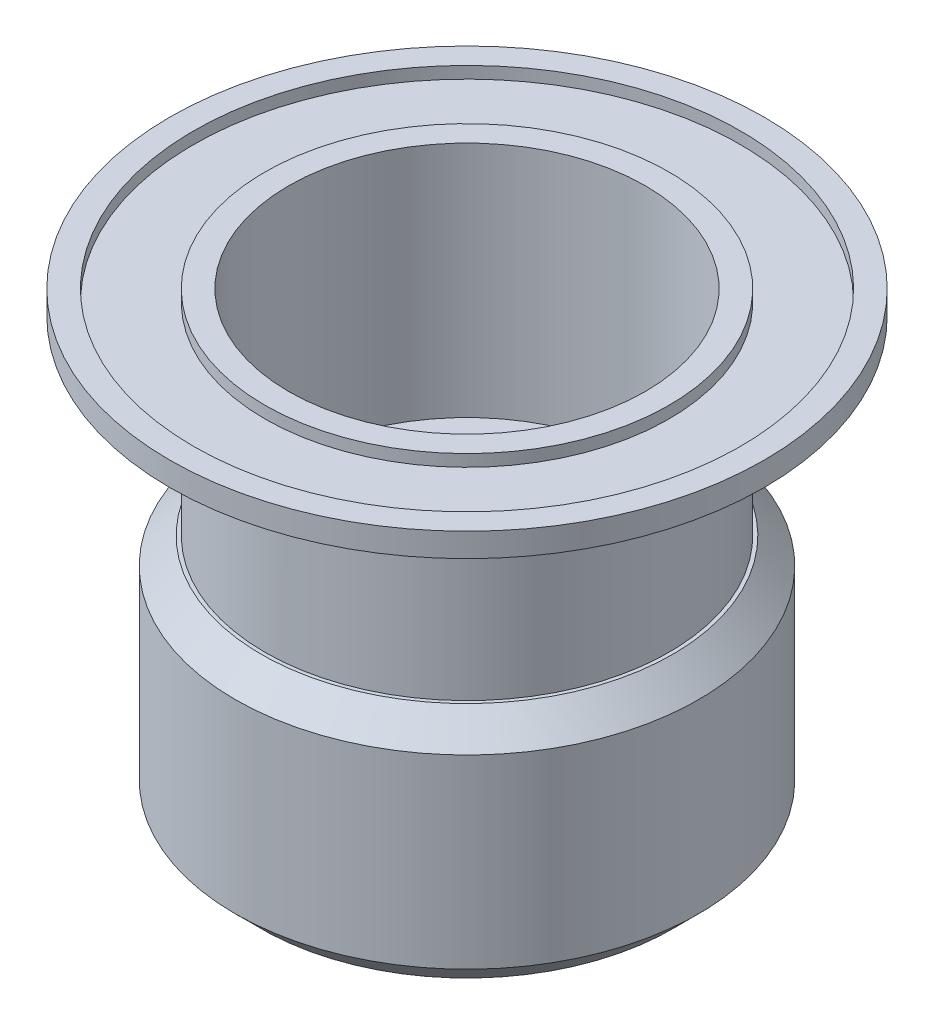
from build123d import *

# Parameters (mm, degrees)
SKETCH_3_R          = 23
SKETCH_3_R_2        = 17
CUT_EXTRUDE_1_DEPTH = 1
SKETCH_4_W          = 10
SKETCH_4_H          = 10
CUT_EXTRUDE_2_DEPTH = 1.5
SKETCH_5_R          = 4
CUT_EXTRUDE_3_DEPTH = 41.620192023
SKETCH_9_R          = 17
SKETCH_9_R_2        = 4
EXTRUDE_1_DEPTH     = 1
SKETCH_10_R         = 17
SKETCH_10_R_2       = 15
EXTRUDE_2_DEPTH     = 15
SKETCH_11_R         = 2.75
CUT_EXTRUDE_4_DEPTH = 42.379342672
EXTRUDE_START       = -20
SKETCH_12_R         = 19.5
SKETCH_12_R_2       = 17
EXTRUDE_3_DEPTH     = 20
CHAMFER_1_SIZE      = 2.195


with BuildPart() as part:
    # Эскиз2 → Повернуть1 (revolve)
    with BuildSketch(Plane.XY, mode=Mode.PRIVATE) as revolve_1_sk:
        Polygon((15, 0), (15, -20), (0, -20), (0, -22), (17, -22), (17, -2), (25, -2), (25, 0), align=None)
    revolve(revolve_1_sk.sketch.rotate(Axis((0, 0, 0), (0, -1, 0)), 90), axis=Axis((0, 0, 0), (0, -1, 0)))

    # Эскиз3 → Вырез-Вытянуть1 (cut)
    with BuildSketch(Plane(origin=(0, 0, 0), x_dir=(1, 0, 0), z_dir=(0, 1, 0))):
        with Locations(Location((0, 0, 0), (0, 0, 270))):
            Circle(SKETCH_3_R)
        with Locations(Location((0, 0, 0), (0, 0, 270))):
            Circle(SKETCH_3_R_2, mode=Mode.SUBTRACT)
    extrude(amount=-CUT_EXTRUDE_1_DEPTH, mode=Mode.SUBTRACT)

    # Эскиз4 → Вырез-Вытянуть2 (cut)
    with BuildSketch(Plane(origin=(0, -20, 0), x_dir=(1, 0, 0), z_dir=(0, 1, 0))):
        Rectangle(SKETCH_4_W, SKETCH_4_H)
    extrude(amount=-CUT_EXTRUDE_2_DEPTH, mode=Mode.SUBTRACT)

    # Эскиз5 → Вырез-Вытянуть3 (cut, through all)
    with BuildSketch(Plane(origin=(0, -20, 0), x_dir=(1, 0, 0), z_dir=(0, 1, 0))):
        with Locations(Location((0, 10, 0), (0, 0, 270))):
            Circle(SKETCH_5_R)
        with Locations(Location((10, 0, 0), (0, 0, 270))):
            Circle(SKETCH_5_R)
        with Locations(Location((0, -10, 0), (0, 0, 270))):
            Circle(SKETCH_5_R)
        with Locations(Location((-10, 0, 0), (0, 0, 270))):
            Circle(SKETCH_5_R)
    extrude(amount=-CUT_EXTRUDE_3_DEPTH, mode=Mode.SUBTRACT)

    # Эскиз9 → Бобышка-Вытянуть1 (add)
    with BuildSketch(Plane.XZ.offset(22)):
        with Locations(Location((0, 0, 0), (0, 0, 90))):
            Circle(SKETCH_9_R)
        with Locations(Location((0, 10, 0), (0, 0, 90))):
            Circle(SKETCH_9_R_2, mode=Mode.SUBTRACT)
        with Locations(Location((-10, 0, 0), (0, 0, 90))):
            Circle(SKETCH_9_R_2, mode=Mode.SUBTRACT)
        with Locations(Location((0, -10, 0), (0, 0, 90))):
            Circle(SKETCH_9_R_2, mode=Mode.SUBTRACT)
        with Locations(Location((10, 0, 0), (0, 0, 90))):
            Circle(SKETCH_9_R_2, mode=Mode.SUBTRACT)
    extrude(amount=EXTRUDE_1_DEPTH)

    # Эскиз10 → Бобышка-Вытянуть2 (add)
    with BuildSketch(Plane.XZ.offset(23)):
        with Locations(Location((0, 0, 0), (0, 0, 90))):
            Circle(SKETCH_10_R)
        with Locations(Location((0, 0, 0), (0, 0, 90))):
            Circle(SKETCH_10_R_2, mode=Mode.SUBTRACT)
    extrude(amount=EXTRUDE_2_DEPTH)

    # Эскиз11 → Вырез-Вытянуть4 (cut, through all)
    with BuildSketch(Plane(origin=(0, -21.5, 0), x_dir=(1, 0, 0), z_dir=(0, 1, 0))):
        with Locations(Location((0, 0, 0), (0, 0, 270))):
            Circle(SKETCH_11_R)
    extrude(amount=-CUT_EXTRUDE_4_DEPTH, mode=Mode.SUBTRACT)

    # Эскиз12 → Бобышка-Вытянуть3 (add)
    with BuildSketch(Plane.XZ.offset(38).offset(EXTRUDE_START)):
        with Locations(Location((0, 0, 0), (0, 0, 270))):
            Circle(SKETCH_12_R)
        with Locations(Location((0, 0, 0), (0, 0, 90))):
            Circle(SKETCH_12_R_2, mode=Mode.SUBTRACT)
    extrude(amount=EXTRUDE_3_DEPTH)

    # Фаска1
    chamfer_1_edges = [part.edges().sort_by_distance(p)[0] for p in [
        (0, -18, 19.5),
        (0, -38, 19.5),
    ]]
    chamfer(chamfer_1_edges, length=CHAMFER_1_SIZE)


solid = part.part
